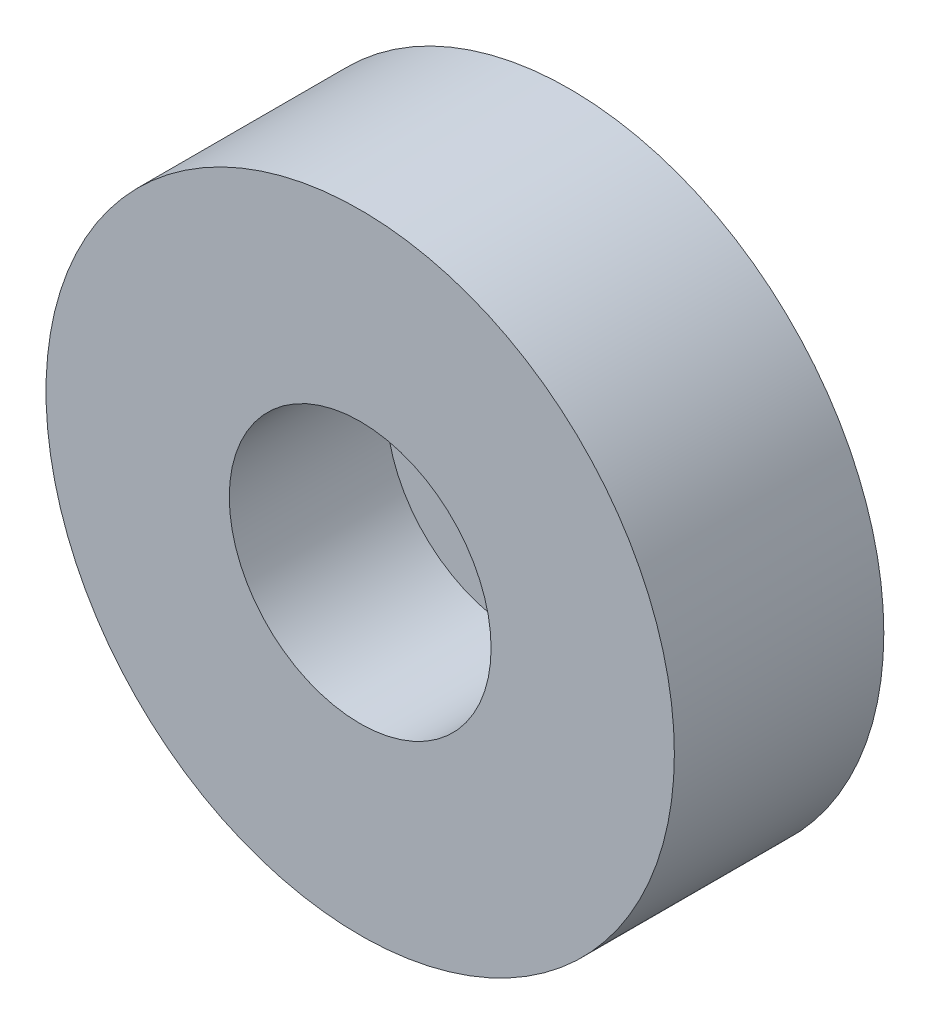
from build123d import *

# Parameters (mm, degrees)
SKIZZE1_R                       = 60
AUFSATZ_LINEAR_AUSTRAGEN1_DEPTH = 40
SKIZZE2_R                       = 25
SCHNITT_LINEAR_AUSTRAGEN1_DEPTH = 30


with BuildPart() as part:
    # Skizze1 → Aufsatz-Linear austragen1 (new body)
    with BuildSketch(Plane.XY):
        Circle(SKIZZE1_R)
    extrude(amount=AUFSATZ_LINEAR_AUSTRAGEN1_DEPTH)

    # Skizze2 → Schnitt-Linear austragen1 (cut)
    with BuildSketch(Plane.XY.offset(40)):
        Circle(SKIZZE2_R)
    extrude(amount=-SCHNITT_LINEAR_AUSTRAGEN1_DEPTH, mode=Mode.SUBTRACT)


solid = part.part
